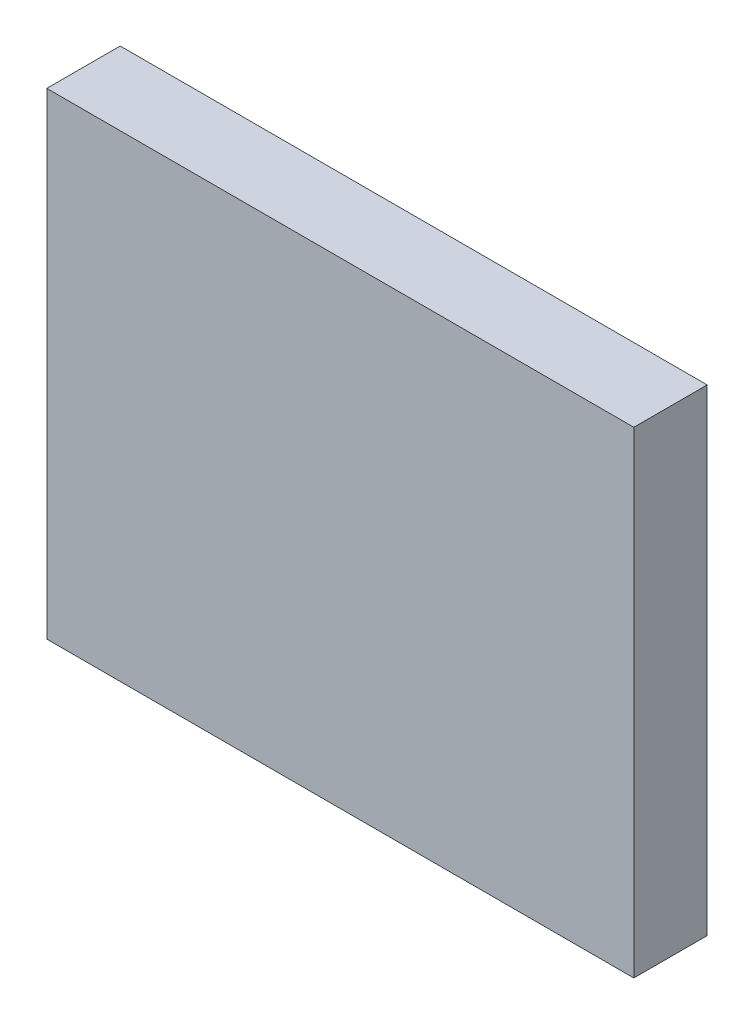
from build123d import *

# Parameters (mm, degrees)
SKETCH1_W           = 160
SKETCH1_H           = 130
BOSS_EXTRUDE1_DEPTH = 20
CUT_EXTRUDE1_DEPTH  = 10


with BuildPart() as part:
    # Sketch1 → Boss-Extrude1 (new body)
    with BuildSketch(Plane.XY):
        with Locations((-80, 65)):
            Rectangle(SKETCH1_W, SKETCH1_H)
    extrude(amount=BOSS_EXTRUDE1_DEPTH)

    # Sketch2 → Cut-Extrude1 (cut)
    with BuildSketch(Plane(origin=(0, 0, 0), x_dir=(-1, 0, 0), z_dir=(0, 0, -1))):
        with BuildLine():
            Line((150, 110), (150, 20))
            ThreePointArc((150, 20), (147.071067812, 12.928932188), (140, 10))
            Line((140, 10), (20, 10))
            ThreePointArc((20, 10), (12.928932188, 12.928932188), (10, 20))
            Line((10, 20), (10, 110))
            ThreePointArc((10, 110), (12.928932188, 117.071067812), (20, 120))
            Line((20, 120), (140, 120))
            ThreePointArc((140, 120), (147.071067812, 117.071067812), (150, 110))
        make_face()
    extrude(amount=-CUT_EXTRUDE1_DEPTH, mode=Mode.SUBTRACT)


solid = part.part
